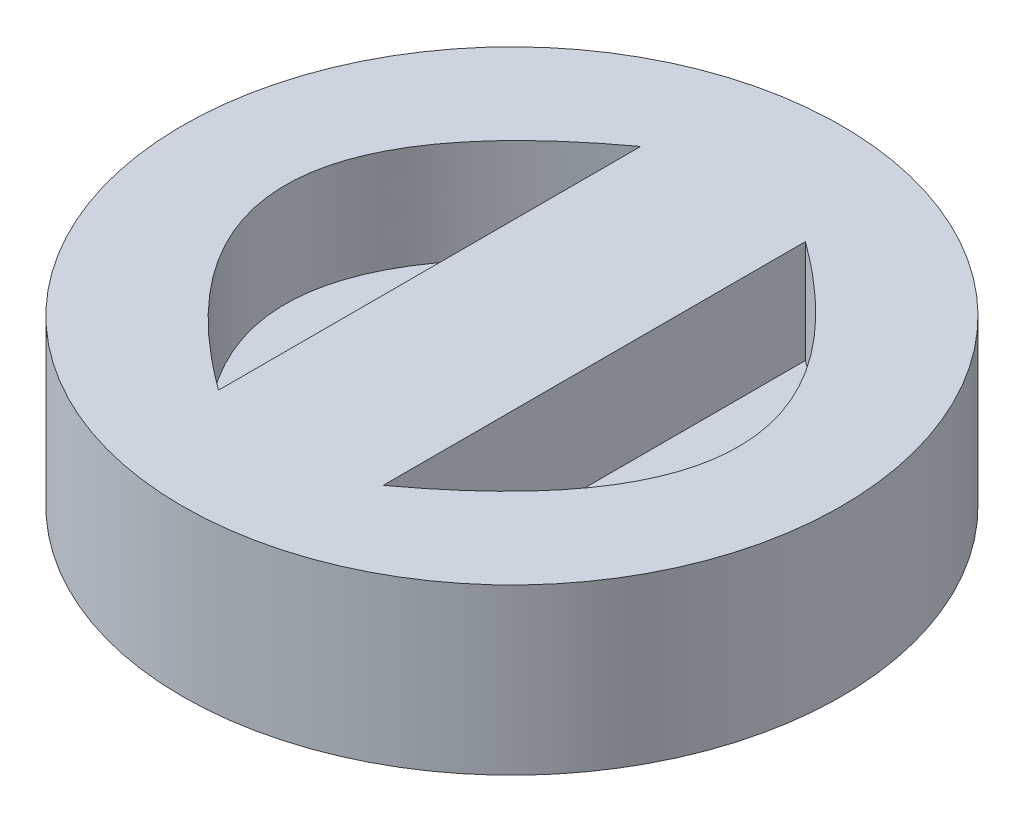
from build123d import *

# Parameters (mm, degrees)
SKETCH1_R           = 16
BOSS_EXTRUDE1_DEPTH = 8
CUT_EXTRUDE2_DEPTH  = 5


with BuildPart() as part:
    # Sketch1 → Boss-Extrude1 (new body)
    with BuildSketch(Plane(origin=(0, 0, 0), x_dir=(1, 0, 0), z_dir=(0, 1, 0))):
        with Locations(Location((-62.417227704, 31.446847546, 0), (0, 0, 270))):
            Circle(SKETCH1_R)
    extrude(amount=BOSS_EXTRUDE1_DEPTH)

    # Sketch9 → Cut-Extrude2 (cut)
    with BuildSketch(Plane(origin=(0, 8, 0), x_dir=(1, 0, 0), z_dir=(0, 1, 0))):
        with BuildLine():
            Line((-66.417227704, 41.693798311), (-66.417227704, 31.446847546))
            Line((-66.417227704, 31.446847546), (-66.417227704, 21.19989678))
            add(Edge.make_bspline(
                [(-66.417227704, 41.693798311), (-80.417227704, 31.446847546), (-66.417227704, 21.19989678)],
                knots=[0, 0, 0, 1, 1, 1], degree=2))
        make_face()
        with BuildLine():
            Line((-58.417227704, 41.693798311), (-58.417227704, 21.19989678))
            add(Edge.make_bspline(
                [(-58.417227704, 41.693798311), (-44.417227704, 31.446847546), (-58.417227704, 21.19989678)],
                knots=[0, 0, 0, 1, 1, 1], degree=2))
        make_face()
    extrude(amount=-CUT_EXTRUDE2_DEPTH, mode=Mode.SUBTRACT)


solid = part.part
